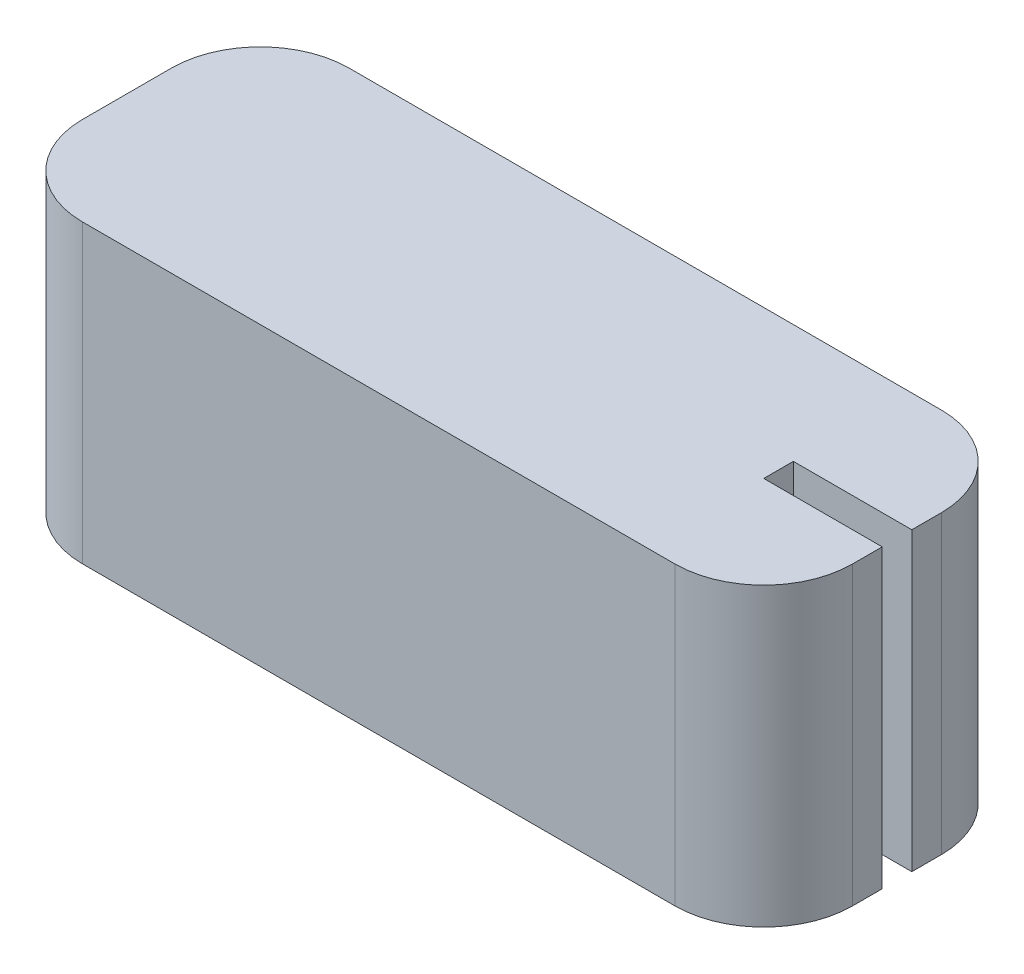
from build123d import *

# Parameters (mm, degrees)
SKETCH1_R               = 3.65
BOSS_EXTRUDE1_DEPTH     = 5
BOSS_EXTRUDE2_START     = -1
BOSS_EXTRUDE2_DEPTH     = 1
SKETCH4_W               = 26
SKETCH4_H               = 9
BOSS_EXTRUDE3_DEPTH     = 5
SKETCH5_W               = 26
SKETCH5_H               = 9
BOSS_EXTRUDE4_DEPTH     = 5
SKETCH6_W               = 1
SKETCH6_H               = 10
CUT_EXTRUDE_THIN1_DEPTH = 4
FILLET1_R               = 3
FILLET2_R               = 3


with BuildPart() as part:
    # Sketch1 → Boss-Extrude1 (new body)
    with BuildSketch(Plane(origin=(0, 0, 0), x_dir=(1, 0, 0), z_dir=(0, 1, 0))):
        with Locations(Location((0, 0, 0), (0, 0, 270))):
            Circle(SKETCH1_R)
    extrude(amount=BOSS_EXTRUDE1_DEPTH)

    # Sketch3 → Boss-Extrude2 (add)
    with BuildSketch(Plane(origin=(0, 5, 0), x_dir=(1, 0, 0), z_dir=(0, 1, 0)).offset(BOSS_EXTRUDE2_START)):
        with BuildLine():
            Line((0.245673077, -3.641722771), (15.775, -2.594103892))
            ThreePointArc((15.775, -2.594103892), (18.2, 0), (15.775, 2.594103892))
            Line((15.775, 2.594103892), (0.245673077, 3.641722771))
            ThreePointArc((0.245673077, 3.641722771), (3.65, 0), (0.245673077, -3.641722771))
        make_face()
    extrude(amount=BOSS_EXTRUDE2_DEPTH)


with BuildPart() as body_2:
    # Sketch4 → Boss-Extrude3 (new body)
    with BuildSketch(Plane(origin=(0, 5, 0), x_dir=(1, 0, 0), z_dir=(0, 1, 0))):
        with Locations((8, 0)):
            Rectangle(SKETCH4_W, SKETCH4_H)
        with BuildLine():
            Line((0.245673077, -3.641722771), (15.775, -2.594103892))
            ThreePointArc((15.775, -2.594103892), (18.2, 0), (15.775, 2.594103892))
            Line((15.775, 2.594103892), (0.245673077, 3.641722771))
            ThreePointArc((0.245673077, 3.641722771), (-3.65, 0), (0.245673077, -3.641722771))
        make_face(mode=Mode.SUBTRACT)
    extrude(amount=-BOSS_EXTRUDE3_DEPTH)

    # Sketch5 → Boss-Extrude4 (add)
    with BuildSketch(Plane(origin=(0, 5, 0), x_dir=(1, 0, 0), z_dir=(0, 1, 0))):
        with Locations((8, 0)):
            Rectangle(SKETCH5_W, SKETCH5_H)
    extrude(amount=BOSS_EXTRUDE4_DEPTH)

    # Sketch6 → Cut-Extrude-Thin1 (cut)
    with BuildSketch(Plane(origin=(21, 0, 0), x_dir=(0, 0, -1), z_dir=(1, 0, 0))):
        with Locations((0, 5)):
            Rectangle(SKETCH6_W, SKETCH6_H)
    extrude(amount=-CUT_EXTRUDE_THIN1_DEPTH, mode=Mode.SUBTRACT)

    # Fillet1
    fillet1_edges = [body_2.edges().sort_by_distance(p)[0] for p in [
        (-5, 5, -4.5),
        (-5, 5, 4.5),
    ]]
    fillet(fillet1_edges, radius=FILLET1_R)

    # Fillet2
    fillet2_edges = [body_2.edges().sort_by_distance(p)[0] for p in [
        (21, 5, -4.5),
        (21, 5, 4.5),
    ]]
    fillet(fillet2_edges, radius=FILLET2_R)


solid = Compound([part.part, body_2.part])
